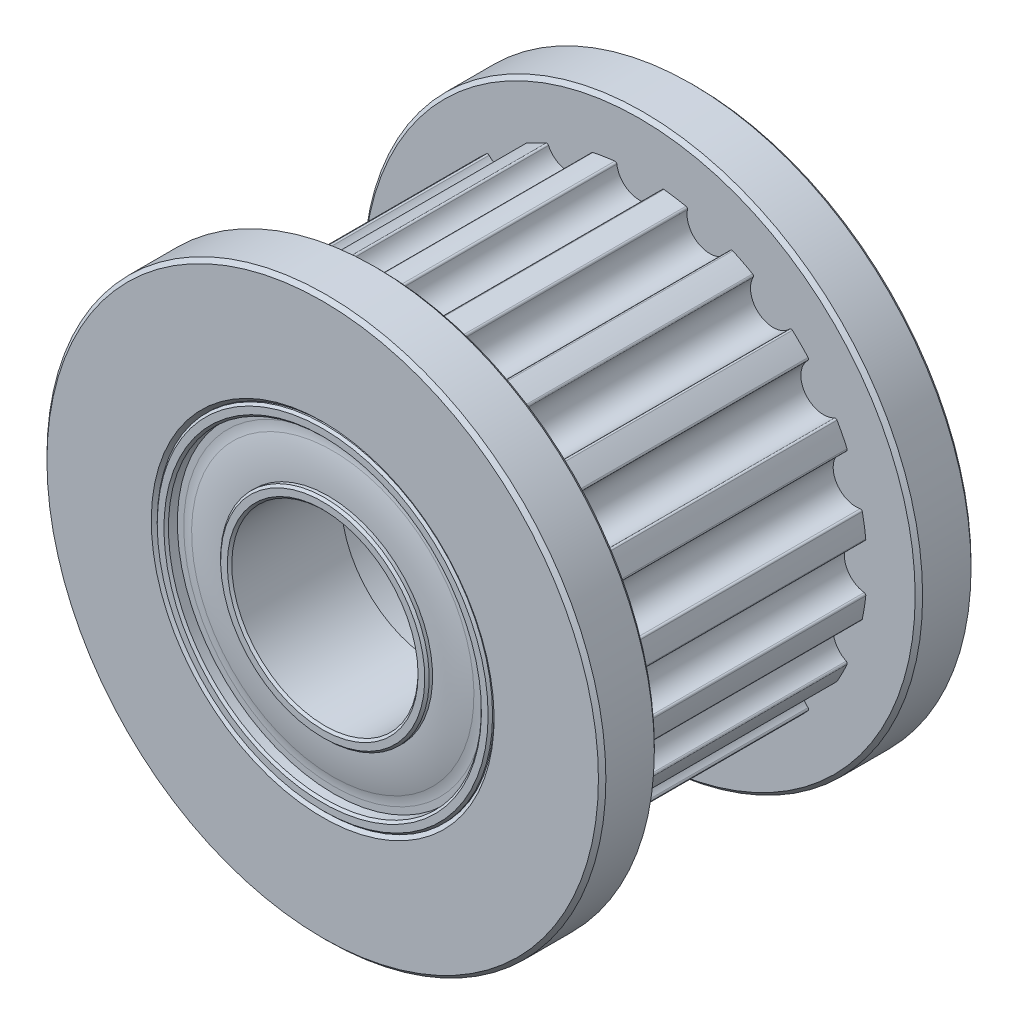
from build123d import *

# Parameters (mm, degrees)
CHAMFER2_SIZE            = 0.06
FILLET2_R                = 1
CHAMFER1_SIZE            = 0.1
CUT_EXTRUDE1_START       = -3.5
CUT_EXTRUDE1_DEPTH       = 7
FILLET1_R                = 0.05
CIRPATTERN3_COUNT        = 20
FILLET1_OF_CIRPATTERN3_R = 0.05


with BuildPart() as part:
    # Sketch2 → Revolve1 (revolve)
    with BuildSketch(Plane(origin=(0, 0, 0), x_dir=(0, 0, -1), z_dir=(1, 0, 0)), mode=Mode.PRIVATE) as revolve1_sk:
        with BuildLine():
            Line((5, 2.5), (2, 2.5))
            Line((2, 2.5), (2, 4.5))
            Line((2, 4.5), (5, 4.5))
            Line((5, 4.5), (5, 4.2))
            Line((5, 4.2), (4.7, 4.2))
            Line((4.7, 4.2), (4.7, 3.9))
            ThreePointArc((4.7, 3.9), (4.812327274, 3.355090083), (4.85, 2.8))
            Line((4.85, 2.8), (5, 2.8))
            Line((5, 2.8), (5, 2.5))
        make_face()
    revolve(revolve1_sk.sketch.rotate(Axis((0, 0, 5), (0, 0, -1)), 180), axis=Axis((0, 0, 5), (0, 0, -1)))

    # Chamfer2
    chamfer2_edges = [part.edges().sort_by_distance(p)[0] for p in [
        (0, 2.5, -5),
        (0, 2.8, -5),
        (0, 4.2, -5),
        (0, 4.5, -5),
    ]]
    chamfer(chamfer2_edges, length=CHAMFER2_SIZE)

    # Fillet2
    fillet2_edges = [part.edges().sort_by_distance(p)[0] for p in [
        (0, 3.9, -4.7),
    ]]
    fillet(fillet2_edges, radius=FILLET2_R)


with BuildPart() as body_2:
    # Mirror1: mirrored copy
    add(part.part.mirror(Plane.XY))


with BuildPart() as body_3:
    # Sketch3 → Revolve2 (revolve)
    with BuildSketch(Plane(origin=(0, 0, 0), x_dir=(0, 0, -1), z_dir=(1, 0, 0)), mode=Mode.PRIVATE) as revolve2_sk:
        Polygon((3.5, 7.5), (5, 7.5), (5, 4.5), (2, 4.5), (2, 3.5), (-2, 3.5), (-2, 4.5), (-5, 4.5), (-5, 7.5), (-3.5, 7.5), (-3.5, 6.11), (3.5, 6.11), align=None)
    revolve(revolve2_sk.sketch.rotate(Axis((0, 0, 5), (0, 0, -1)), 180), axis=Axis((0, 0, 5), (0, 0, -1)))

    # Chamfer1
    chamfer1_edges = [body_3.edges().sort_by_distance(p)[0] for p in [
        (0, 4.5, 5),
        (0, 4.5, -5),
        (0, 7.5, -5),
        (0, 7.5, -3.5),
        (0, 7.5, 3.5),
        (0, 7.5, 5),
    ]]
    chamfer(chamfer1_edges, length=CHAMFER1_SIZE)

    # Sketch4 → Cut-Extrude1 (cut)
    with BuildSketch(Plane.XY.offset(CUT_EXTRUDE1_START)):
        with BuildLine():
            Line((-0.611, 6.11), (0.611, 6.11))
            ThreePointArc((0.611, 6.11), (0, 5.499), (-0.611, 6.11))
        make_face()
    cut_extrude1 = extrude(amount=CUT_EXTRUDE1_DEPTH, mode=Mode.SUBTRACT)

    # Fillet1
    fillet1_edges = [body_3.edges().sort_by_distance(p)[0] for p in [
        (0.610235772, 6.07945, 0),
        (-0.610235772, 6.07945, 0),
    ]]
    fillet(fillet1_edges, radius=FILLET1_R)

    # CirPattern3: Cut-Extrude1 ×20 about axis
    cirpattern3_axis = Axis((0, 0, 0), (0, 0, 1))
    for i in range(1, CIRPATTERN3_COUNT):
        add(cut_extrude1.rotate(cirpattern3_axis, i * 360 / CIRPATTERN3_COUNT), mode=Mode.SUBTRACT)

    # Fillet1 of CirPattern3
    fillet1_of_cirpattern3_edges = [body_3.edges().sort_by_distance(p)[0] for p in [
        (-1.298284659, 5.970473762, 0),
        (-2.459022074, 5.593327314, 0),
        (-3.079719942, 5.277065954, 0),
        (-4.067102162, 4.559690779, 0),
        (-4.559690779, 4.067102162, 0),
        (-5.277065954, 3.079719942, 0),
        (-5.593327314, 2.459022074, 0),
        (-5.970473762, 1.298284659, 0),
        (-6.07945, 0.610235772, 0),
        (-6.07945, -0.610235772, 0),
        (-5.970473762, -1.298284659, 0),
        (-5.593327314, -2.459022074, 0),
        (-5.277065954, -3.079719942, 0),
        (-4.559690779, -4.067102162, 0),
        (-4.067102162, -4.559690779, 0),
        (-3.079719942, -5.277065954, 0),
        (-2.459022074, -5.593327314, 0),
        (-1.298284659, -5.970473762, 0),
        (-0.610235772, -6.07945, 0),
        (0.610235772, -6.07945, 0),
        (1.298284659, -5.970473762, 0),
        (2.459022074, -5.593327314, 0),
        (3.079719942, -5.277065954, 0),
        (4.067102162, -4.559690779, 0),
        (4.559690779, -4.067102162, 0),
        (5.277065954, -3.079719942, 0),
        (5.593327314, -2.459022074, 0),
        (5.970473762, -1.298284659, 0),
        (6.07945, -0.610235772, 0),
        (6.07945, 0.610235772, 0),
        (5.970473762, 1.298284659, 0),
        (5.593327314, 2.459022074, 0),
        (5.277065954, 3.079719942, 0),
        (4.559690779, 4.067102162, 0),
        (4.067102162, 4.559690779, 0),
        (3.079719942, 5.277065954, 0),
        (2.459022074, 5.593327314, 0),
        (1.298284659, 5.970473762, 0),
    ]]
    fillet(fillet1_of_cirpattern3_edges, radius=FILLET1_OF_CIRPATTERN3_R)


solid = Compound([part.part, body_2.part, body_3.part])
